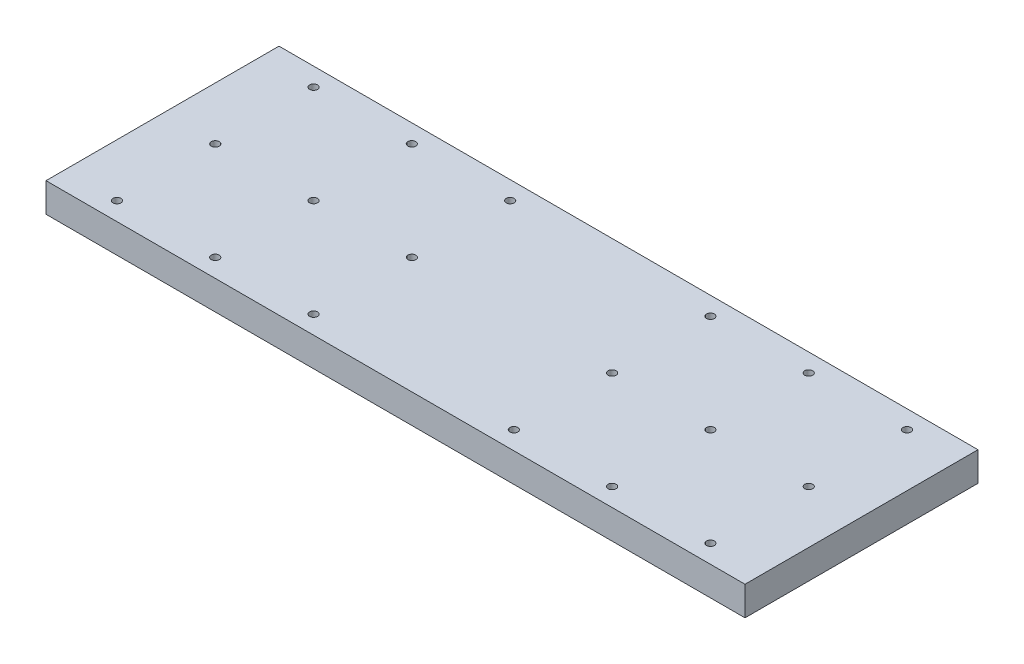
from build123d import *

# Parameters (mm, degrees)
SKETCH1_W             = 304.8
SKETCH1_H             = 101.6
BOSS_EXTRUDE1_DEPTH   = 12.7
F_8_32_TAPPED_HOLE1_D = 3.4544


with BuildPart() as part:
    # Sketch1 → Boss-Extrude1 (new body)
    with BuildSketch(Plane(origin=(0, 0, 0), x_dir=(1, 0, 0), z_dir=(0, 1, 0))):
        with Locations((152.4, 50.8)):
            Rectangle(SKETCH1_W, SKETCH1_H)
    extrude(amount=BOSS_EXTRUDE1_DEPTH)

    # #8-32 Tapped Hole1 (through all)
    with Locations(Plane(origin=(0, 12.7, 0), x_dir=(1, 0, 0), z_dir=(0, 1, 0))):
        with Locations((23.01875, 93.6625), (65.857160482, 93.6625), (108.74375, 93.6625), (196.05625, 93.6625), (238.91875, 93.6625), (281.78125, 93.6625), (23.01875, 50.8), (65.857160482, 50.8), (108.74375, 50.8), (196.05625, 50.8), (238.91875, 50.8), (281.78125, 50.8), (23.01875, 7.9375), (65.857160482, 7.9375), (108.74375, 7.9375), (196.05625, 7.9375), (238.91875, 7.9375), (281.78125, 7.9375)):
            Hole(F_8_32_TAPPED_HOLE1_D / 2)


solid = part.part
